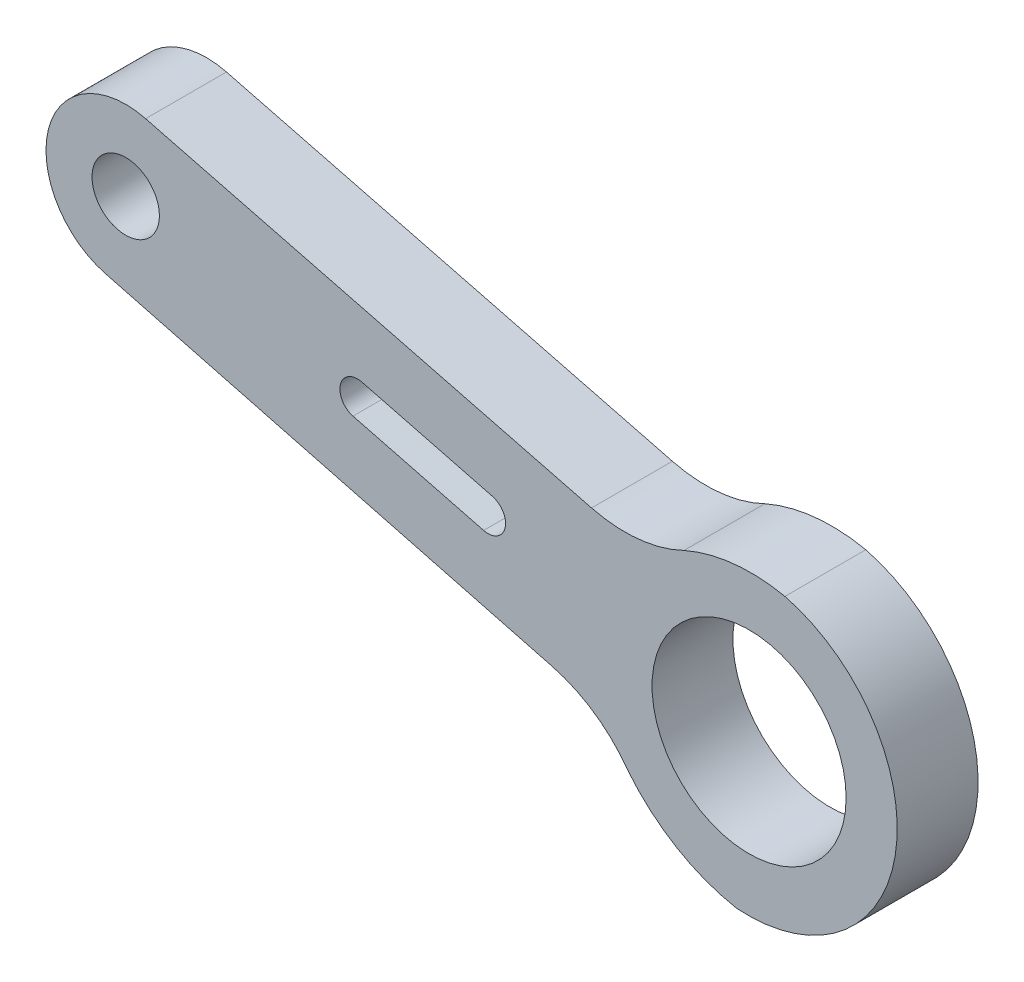
from build123d import *

# Parameters (mm, degrees)
SKETCH_1_R      = 3.6
SKETCH_1_R_2    = 1.25
EXTRUDE_1_DEPTH = 3


with BuildPart() as part:
    # 草圖1 → 填料-伸長1 (new body)
    with BuildSketch(Plane.XY):
        with BuildLine():
            Line((243.635524691, 78.984013539), (260.167543031, 74.664105375))
            ThreePointArc((260.167543031, 74.664105375), (261.762807038, 73.939164867), (263.0099811, 72.708326596))
            ThreePointArc((263.0099811, 72.708326596), (264.804382383, 71.148673452), (267.027735224, 70.306595047))
            ThreePointArc((267.027735224, 70.306595047), (267.669348827, 70.295848059), (268.307919069, 70.359184927))
            ThreePointArc((268.307919069, 70.359184927), (271.821757968, 72.430801884), (272.972563608, 76.344151728))
            ThreePointArc((272.972563608, 76.344151728), (271.674549014, 79.439761285), (268.83007541, 81.222066065))
            ThreePointArc((268.83007541, 81.222066065), (266.927260325, 81.319865813), (265.086550743, 80.827871636))
            ThreePointArc((265.086550743, 80.827871636), (263.401602385, 80.346994525), (261.654207062, 80.477007409))
            Line((261.654207062, 80.477007409), (245.112048777, 84.71112347))
            ThreePointArc((245.112048777, 84.71112347), (241.510232103, 82.585830461), (243.635524691, 78.984013539))
        make_face()
        with Locations((267.499543018, 75.885430609)):
            Circle(SKETCH_1_R, mode=Mode.SUBTRACT)
        with Locations((244.373787095, 81.847568395)):
            Circle(SKETCH_1_R_2, mode=Mode.SUBTRACT)
        with BuildLine():
            Line((257.981059369, 79.010683825), (253.134508891, 80.260187472))
            ThreePointArc((253.134508891, 80.260187472), (252.340612803, 79.796798865), (252.80400141, 79.002902777))
            Line((252.80400141, 79.002902777), (257.650550117, 77.753399602))
            ThreePointArc((257.650550117, 77.753399602), (258.444446854, 78.216787087), (257.981059369, 79.010683825))
        make_face(mode=Mode.SUBTRACT)
    extrude(amount=EXTRUDE_1_DEPTH)


solid = part.part
